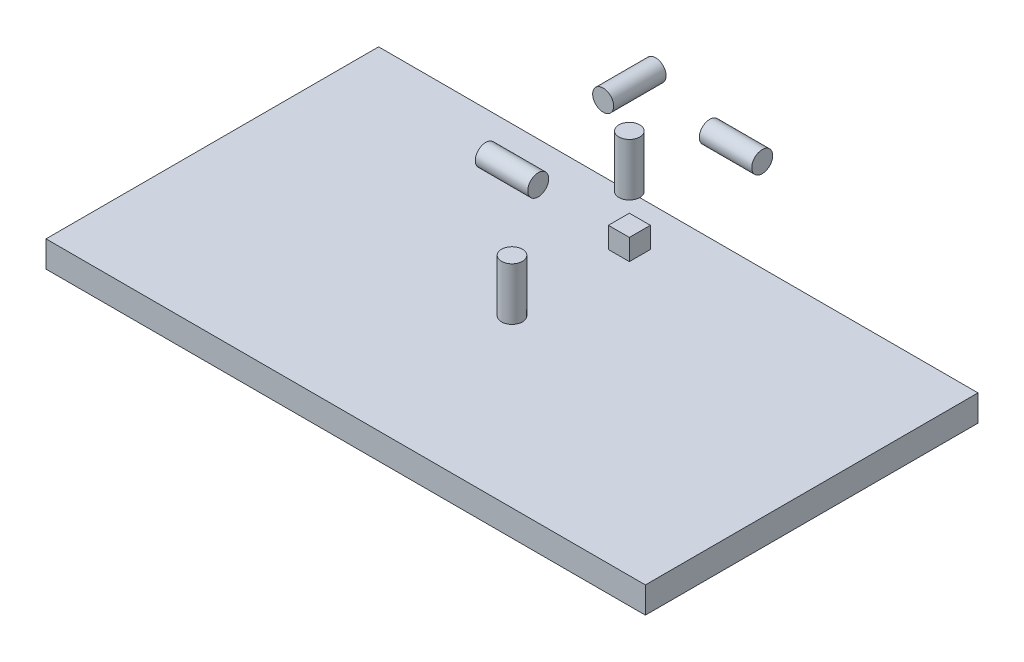
from build123d import *

# Parameters (mm, degrees)
SKETCH1_W           = 228.511799864
SKETCH1_H           = 126.804235764
BOSS_EXTRUDE1_DEPTH = 10
SKETCH2_R           = 4
BOSS_EXTRUDE2_DEPTH = 20
SKETCH3_R           = 4
BOSS_EXTRUDE3_DEPTH = 10
SKETCH4_W           = 8
SKETCH4_H           = 8
BOSS_EXTRUDE4_DEPTH = 4
SKETCH5_R           = 4
BOSS_EXTRUDE5_DEPTH = 10
SKETCH7_R           = 4
BOSS_EXTRUDE6_DEPTH = 10
SKETCH9_R           = 4
BOSS_EXTRUDE7_DEPTH = 10


with BuildPart() as part:
    # Sketch1 → Boss-Extrude1 (new body)
    with BuildSketch(Plane(origin=(0, 0, 0), x_dir=(1, 0, 0), z_dir=(0, 1, 0))):
        Rectangle(SKETCH1_W, SKETCH1_H)
    extrude(amount=-BOSS_EXTRUDE1_DEPTH)

    # Sketch2 → Boss-Extrude2 (add)
    with BuildSketch(Plane(origin=(0, 0, 0), x_dir=(1, 0, 0), z_dir=(0, 1, 0))):
        with Locations(Location((0, 0, 0), (0, 0, 270))):
            Circle(SKETCH2_R)
    extrude(amount=BOSS_EXTRUDE2_DEPTH)


with BuildPart() as body_2:
    # Sketch3 → Boss-Extrude3 (new, symmetric)
    with BuildSketch(Plane(origin=(0, 0, 0), x_dir=(0, 0, -1), z_dir=(1, 0, 0))):
        with Locations((0, 48.274165168)):
            Circle(SKETCH3_R)
    extrude(amount=BOSS_EXTRUDE3_DEPTH, both=True)


with BuildPart() as body_3:
    # Sketch4 → Boss-Extrude4 (new, symmetric)
    with BuildSketch(Plane(origin=(44.745139913, 0, 0), x_dir=(0, 0, -1), z_dir=(1, 0, 0))):
        with Locations((0, 48.274165168)):
            Rectangle(SKETCH4_W, SKETCH4_H)
    extrude(amount=BOSS_EXTRUDE4_DEPTH, both=True)


with BuildPart() as body_4:
    # Sketch5 → Boss-Extrude5 (new, symmetric)
    with BuildSketch(Plane(origin=(0, 73.443144658, 0), x_dir=(1, 0, 0), z_dir=(0, 1, 0))):
        with Locations(Location((44.745139913, 0, 0), (0, 0, 270))):
            Circle(SKETCH5_R)
    extrude(amount=BOSS_EXTRUDE5_DEPTH, both=True)


with BuildPart() as body_5:
    # Sketch7 → Boss-Extrude6 (new, symmetric)
    with BuildSketch(Plane.XY):
        with Locations((44.745139913, 98.612124149)):
            Circle(SKETCH7_R)
    extrude(amount=BOSS_EXTRUDE6_DEPTH, both=True)


with BuildPart() as body_6:
    # Sketch9 → Boss-Extrude7 (new, symmetric)
    with BuildSketch(Plane(origin=(85.396981005, 0, 0), x_dir=(0, 0, -1), z_dir=(1, 0, 0))):
        with Locations((0, 98.612124149)):
            Circle(SKETCH9_R)
    extrude(amount=BOSS_EXTRUDE7_DEPTH, both=True)


solid = Compound([part.part, body_2.part, body_3.part, body_4.part, body_5.part, body_6.part])
